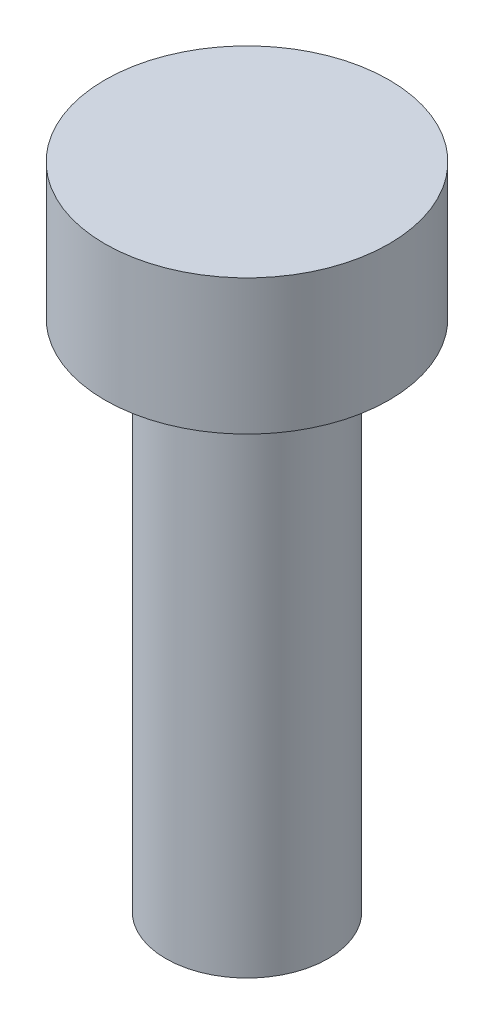
from build123d import *

# Parameters (mm, degrees)
SKETCH1_R           = 2.667
BOSS_EXTRUDE1_DEPTH = 2.54
SKETCH2_R           = 1.524
BOSS_EXTRUDE2_DEPTH = 9.652


with BuildPart() as part:
    # Sketch1 → Boss-Extrude1 (new body)
    with BuildSketch(Plane(origin=(0, 0, 0), x_dir=(1, 0, 0), z_dir=(0, 1, 0))):
        with Locations(Location((0, 0, 0), (0, 0, 270))):
            Circle(SKETCH1_R)
    extrude(amount=BOSS_EXTRUDE1_DEPTH)

    # Sketch2 → Boss-Extrude2 (add)
    with BuildSketch(Plane(origin=(0, 0, 0), x_dir=(-1, 0, 0), z_dir=(0, -1, 0))):
        with Locations(Location((0, 0, 0), (0, 0, 270))):
            Circle(SKETCH2_R)
    extrude(amount=BOSS_EXTRUDE2_DEPTH)


solid = part.part
